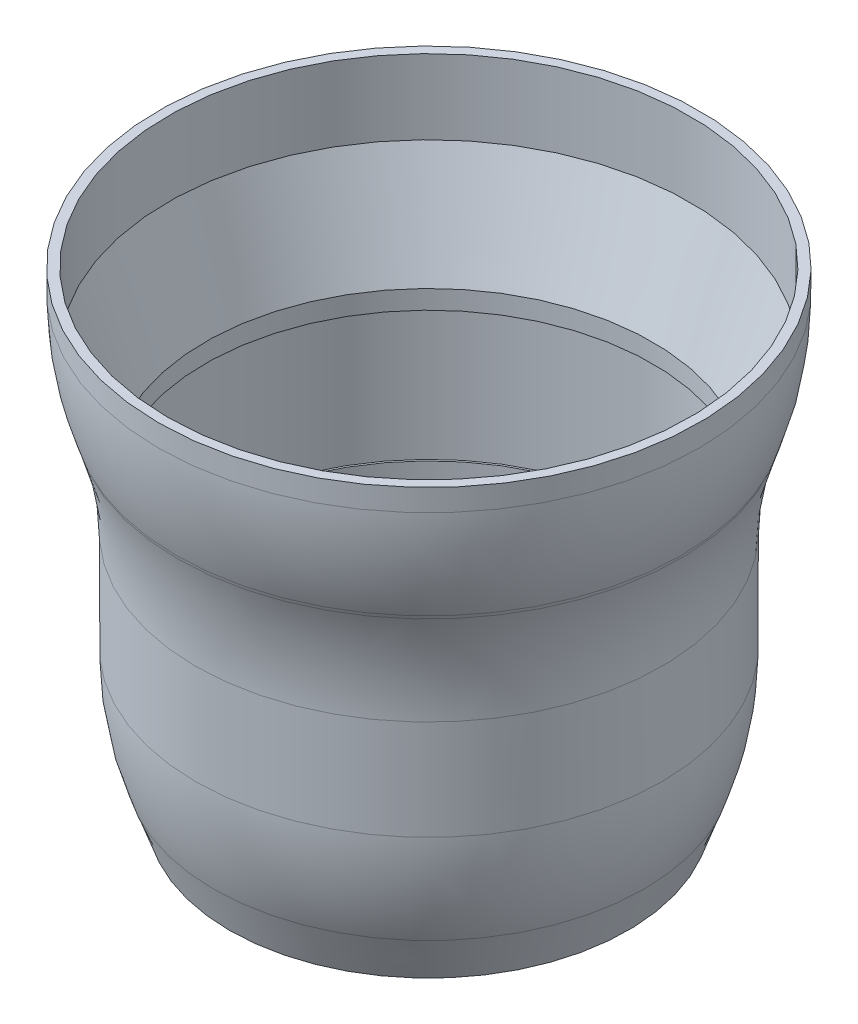
from build123d import *

# Parameters (mm, degrees)
FILLET1_R = 160


with BuildPart() as part:
    # Sketch1 → Revolve1 (revolve)
    with BuildSketch(Plane(origin=(0, 0, 0), x_dir=(0, 0, -1), z_dir=(1, 0, 0)), mode=Mode.PRIVATE) as revolve1_sk:
        Polygon((140, 159.946981615), (145, 159.946981615), (145, 119.946981615), (125, 64.997433226), (125, -45.002566774), (106.801488287, -95.002566774), (101.801488287, -95.002566774), (120, -45.002566774), (120, -15.087139211), (121, -15.087139211), (121, 54.912860789), (120, 54.912860789), (120, 64.997433226), (140, 119.946981615), align=None)
    revolve(revolve1_sk.sketch.rotate(Axis((0, 159.946981615, 0), (0, -1, 0)), 180), axis=Axis((0, 159.946981615, 0), (0, -1, 0)))

    # Fillet1
    fillet1_edges = [part.edges().sort_by_distance(p)[0] for p in [
        (0, -45.002566774, -125),
        (0, 64.997433226, -125),
        (0, 119.946981615, -145),
    ]]
    fillet(fillet1_edges, radius=FILLET1_R)


solid = part.part
